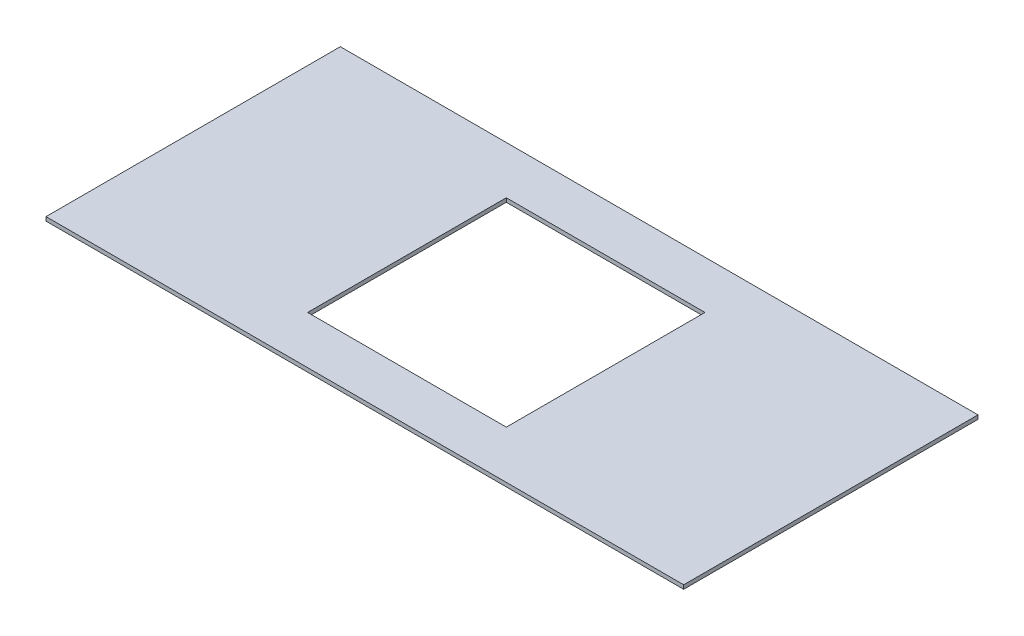
from build123d import *

# Parameters (mm, degrees)
SKETCH2_W           = 130
SKETCH2_H           = 60
BOSS_EXTRUDE1_DEPTH = 0.8
SKETCH3_W           = 40.5
SKETCH3_H           = 40.5
CUT_EXTRUDE1_DEPTH  = 3


with BuildPart() as part:
    # Sketch2 → Boss-Extrude1 (new body)
    with BuildSketch(Plane(origin=(0, 0, 0), x_dir=(1, 0, 0), z_dir=(0, 1, 0))):
        Rectangle(SKETCH2_W, SKETCH2_H)
    extrude(amount=BOSS_EXTRUDE1_DEPTH)

    # Sketch3 → Cut-Extrude1 (cut)
    with BuildSketch(Plane(origin=(0, 0, 0), x_dir=(1, 0, 0), z_dir=(0, 1, 0))):
        with Locations((-1.163623019, 0)):
            Rectangle(SKETCH3_W, SKETCH3_H)
    extrude(amount=CUT_EXTRUDE1_DEPTH, mode=Mode.SUBTRACT)


solid = part.part
